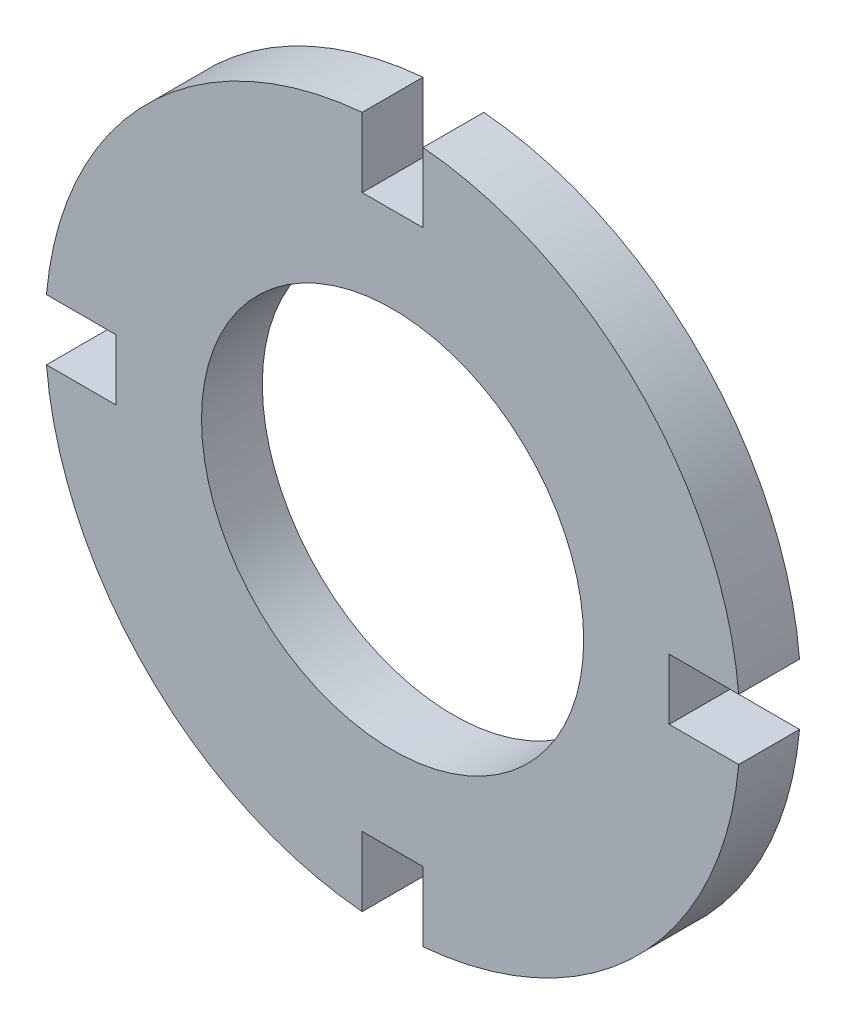
from build123d import *

# Parameters (mm, degrees)
SKETCH1_R           = 13.97
BOSS_EXTRUDE1_DEPTH = 4.445


with BuildPart() as part:
    # Sketch1 → Boss-Extrude1 (new body)
    with BuildSketch(Plane.XY):
        with BuildLine():
            Line((25.302578796, -2.2225), (20.222578796, -2.2225))
            Line((20.222578796, -2.2225), (20.222578796, 2.2225))
            Line((20.222578796, 2.2225), (25.302578796, 2.2225))
            ThreePointArc((25.302578796, 2.2225), (17.960512242, 17.960512242), (2.2225, 25.302578796))
            Line((2.2225, 25.302578796), (2.2225, 20.222578796))
            Line((2.2225, 20.222578796), (-2.2225, 20.222578796))
            Line((-2.2225, 20.222578796), (-2.2225, 25.302578796))
            ThreePointArc((-2.2225, 25.302578796), (-17.960512242, 17.960512242), (-25.302578796, 2.2225))
            Line((-25.302578796, 2.2225), (-20.222578796, 2.2225))
            Line((-20.222578796, 2.2225), (-20.222578796, -2.2225))
            Line((-20.222578796, -2.2225), (-25.302578796, -2.2225))
            ThreePointArc((-25.302578796, -2.2225), (-17.960512242, -17.960512242), (-2.2225, -25.302578796))
            Line((-2.2225, -25.302578796), (-2.2225, -20.222578796))
            Line((-2.2225, -20.222578796), (2.2225, -20.222578796))
            Line((2.2225, -20.222578796), (2.2225, -25.302578796))
            ThreePointArc((2.2225, -25.302578796), (17.960512242, -17.960512242), (25.302578796, -2.2225))
        make_face()
        Circle(SKETCH1_R, mode=Mode.SUBTRACT)
    extrude(amount=BOSS_EXTRUDE1_DEPTH)


solid = part.part
